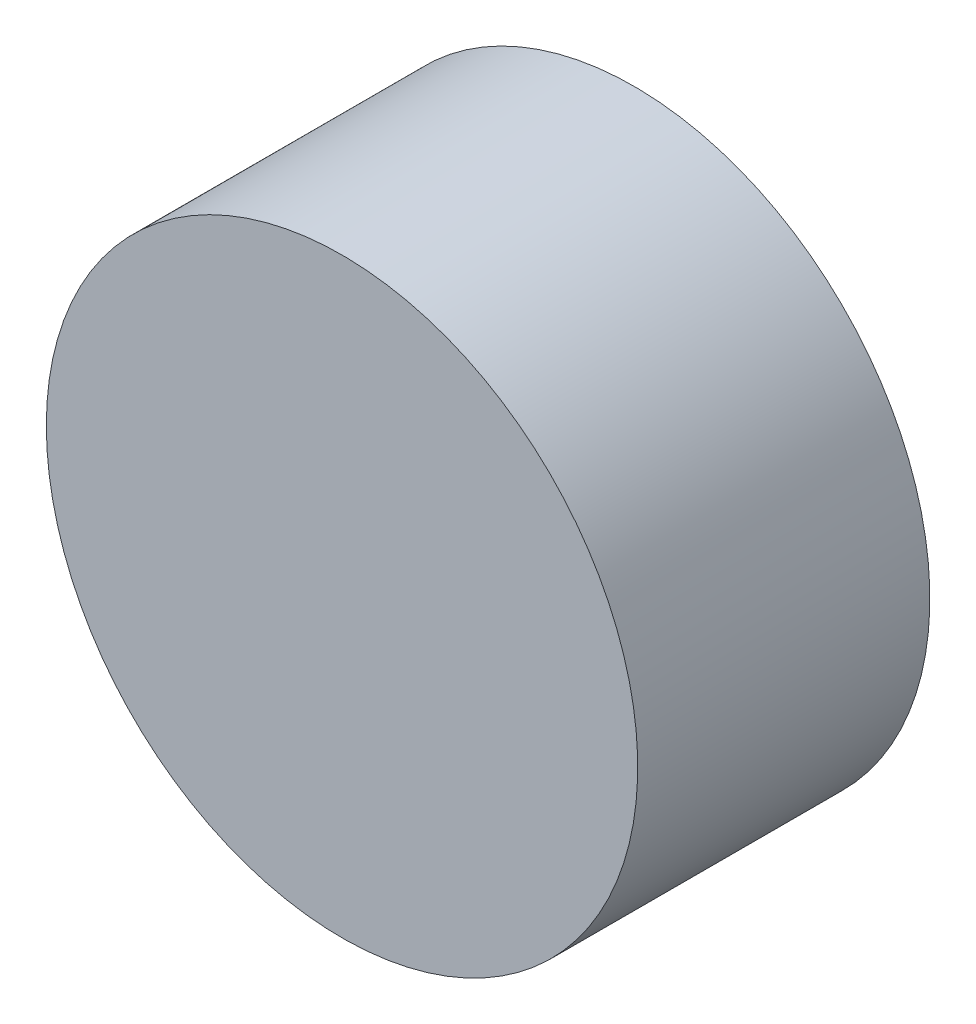
from build123d import *

# Parameters (mm, degrees)
SKETCH1_W = 10.123456789
SKETCH1_H = 10


with BuildPart() as part:
    # Sketch1 → Revolve1 (revolve)
    with BuildSketch(Plane.XZ, mode=Mode.PRIVATE) as revolve1_sk:
        with Locations((5.061728395, 5)):
            Rectangle(SKETCH1_W, SKETCH1_H)
    revolve(revolve1_sk.sketch.rotate(Axis((0, 0, 10), (0, 0, -1)), 180), axis=Axis((0, 0, 10), (0, 0, -1)))


solid = part.part
